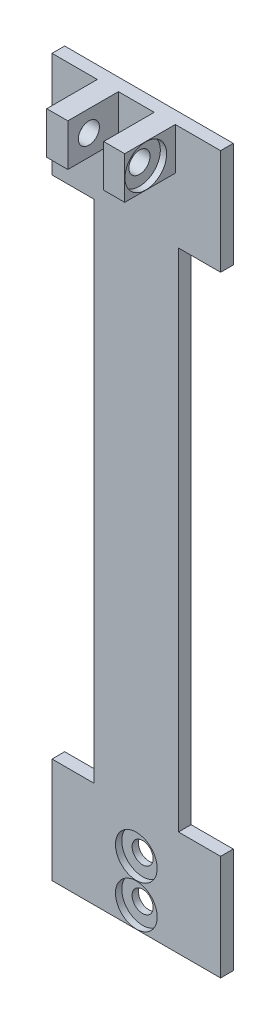
from build123d import *

# Parameters (mm, degrees)
SKETCH1_R             = 4.95
SKETCH1_W             = 5
SKETCH1_H             = 10
SKETCH1_W_2           = 8.5
BODY_DEPTH            = 3
SKETCH1_3_R           = 4.95
SKETCH1_3_R_2         = 2.5
MOUNT_INSETS_DEPTH    = 1.5
SKETCH1_5_W           = 5
SKETCH1_5_H           = 10
HINGE_DEPTH           = 15
SKETCH2_R             = 4.95
SKETCH2_R_2           = 2.5
HINGE_INSET_DEPTH     = 1.5
HINGE_START           = -17
SKETCH2_2_R           = 4.95
SKETCH2_2_R_2         = 2.5
HINGE_INSET2_DEPTH    = 1.5
SKETCH2_3_R           = 2.5
HINGE_SCREWHOLE_DEPTH = 120.897733068


with BuildPart() as part:
    # Sketch1 → Body (new body)
    # profile 1 of 4: a face of its own
    with BuildSketch(Plane.XY):
        Polygon((-23.27588231, 115.303529412), (-34.02588231, 115.303529412), (-34.02588231, 90.303529412), (-24.02588231, 90.303529412), (-24.02588231, -29.696470588), (-34.02588231, -29.696470588), (-34.02588231, -54.696470588), (5.97411769, -54.696470588), (5.97411769, -29.696470588), (-4.02588231, -29.696470588), (-4.02588231, 90.303529412), (5.97411769, 90.303529412), (5.97411769, 115.303529412), (-4.77588231, 115.303529412), (-4.77588231, 105.303529412), (-9.77588231, 105.303529412), (-18.27588231, 105.303529412), (-23.27588231, 105.303529412), align=None)
        with Locations((-14.02588231, -49.696470588)):
            Circle(SKETCH1_R, mode=Mode.SUBTRACT)
        with Locations((-14.02588231, -39.696470588)):
            Circle(SKETCH1_R, mode=Mode.SUBTRACT)
    # profile 2 of 4: a face of its own
    with BuildSketch(Plane.XY):
        with Locations((-20.77588231, 110.303529412)):
            Rectangle(SKETCH1_W, SKETCH1_H)
    # profile 3 of 4: a face of its own
    with BuildSketch(Plane.XY):
        with Locations((-14.02588231, 110.303529412)):
            Rectangle(SKETCH1_W_2, SKETCH1_H)
    # profile 4 of 4: a face of its own
    with BuildSketch(Plane.XY):
        with Locations((-7.27588231, 110.303529412)):
            Rectangle(SKETCH1_W, SKETCH1_H)
    extrude(amount=BODY_DEPTH)

    # Sketch1<3> → Mount Insets (add)
    # profile 1 of 2: a face of its own
    with BuildSketch(Plane.XY):
        with Locations((-14.02588231, -39.696470588)):
            Circle(SKETCH1_3_R)
        with Locations((-14.02588231, -39.696470588)):
            Circle(SKETCH1_3_R_2, mode=Mode.SUBTRACT)
    # profile 2 of 2: a face of its own
    with BuildSketch(Plane.XY):
        with Locations((-14.02588231, -49.696470588)):
            Circle(SKETCH1_3_R)
        with Locations((-14.02588231, -49.696470588)):
            Circle(SKETCH1_3_R_2, mode=Mode.SUBTRACT)
    extrude(amount=MOUNT_INSETS_DEPTH)

    # Sketch1<5> → Hinge (add)
    with BuildSketch(Plane.XY):
        with Locations((-7.27588231, 110.303529412)):
            Rectangle(SKETCH1_5_W, SKETCH1_5_H)
        with Locations((-20.77588231, 110.303529412)):
            Rectangle(SKETCH1_5_W, SKETCH1_5_H)
    extrude(amount=HINGE_DEPTH)

    # Sketch2 → Hinge Inset (cut)
    with BuildSketch(Plane(origin=(-4.77588231, 0, 0), x_dir=(0, 0, -1), z_dir=(1, 0, 0))):
        with Locations((-10, 110.303529412)):
            Circle(SKETCH2_R)
        with Locations((-10, 110.303529412)):
            Circle(SKETCH2_R_2, mode=Mode.SUBTRACT)
    extrude(amount=-HINGE_INSET_DEPTH, mode=Mode.SUBTRACT)

    # Sketch2<2> → Hinge Inset2 (cut)
    with BuildSketch(Plane(origin=(-4.77588231, 0, 0), x_dir=(0, 0, -1), z_dir=(1, 0, 0)).offset(HINGE_START)):
        with Locations((-10, 110.303529412)):
            Circle(SKETCH2_2_R)
        with Locations((-10, 110.303529412)):
            Circle(SKETCH2_2_R_2, mode=Mode.SUBTRACT)
    extrude(amount=-HINGE_INSET2_DEPTH, mode=Mode.SUBTRACT)

    # Sketch2<3> → Hinge Screwhole (cut, through all)
    with BuildSketch(Plane(origin=(-4.77588231, 0, 0), x_dir=(0, 0, -1), z_dir=(1, 0, 0))):
        with Locations(Location((-10, 110.303529412, 0), (0, 0, 270))):
            Circle(SKETCH2_3_R)
    extrude(amount=-HINGE_SCREWHOLE_DEPTH, mode=Mode.SUBTRACT)


solid = part.part
